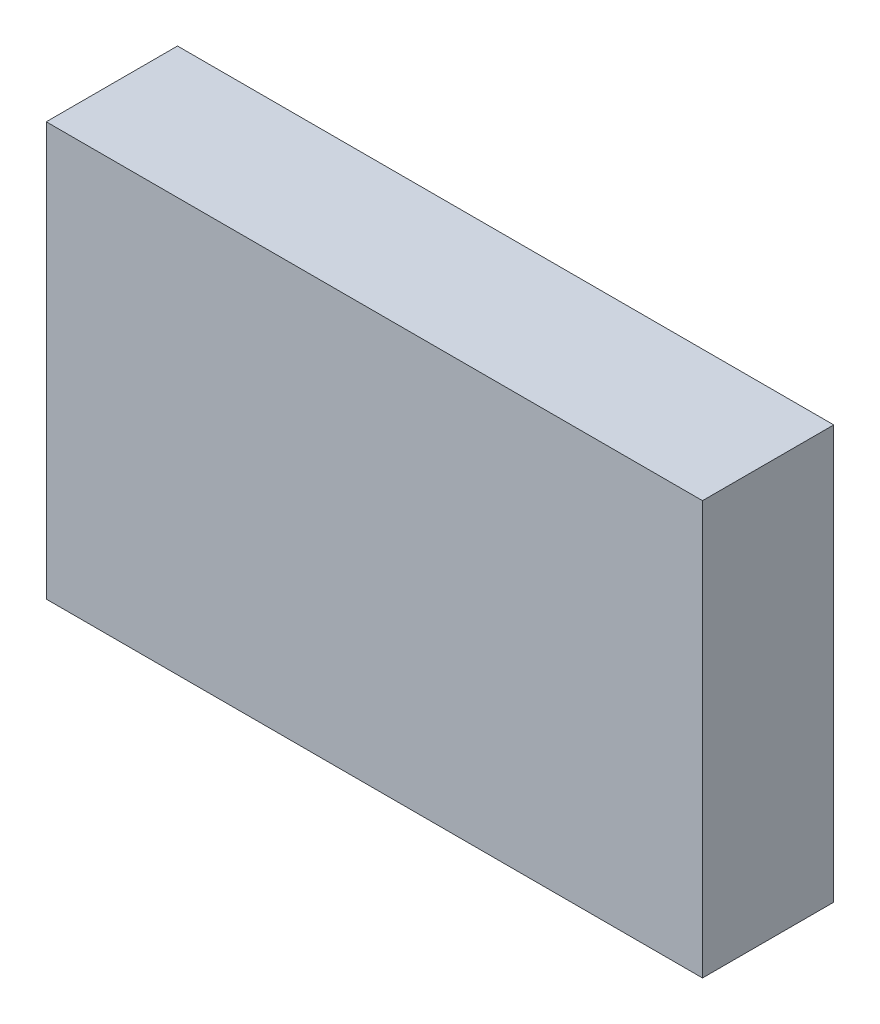
from build123d import *

# Parameters (mm, degrees)
SKETCH1_W           = 12.7
SKETCH1_H           = 2.54
BOSS_EXTRUDE1_DEPTH = 8


with BuildPart() as part:
    # Sketch1 → Boss-Extrude1 (new body)
    with BuildSketch(Plane(origin=(0, 0, 0), x_dir=(1, 0, 0), z_dir=(0, 1, 0))):
        with Locations((3.18369863, -0.104383562)):
            Rectangle(SKETCH1_W, SKETCH1_H)
    extrude(amount=BOSS_EXTRUDE1_DEPTH)


solid = part.part
